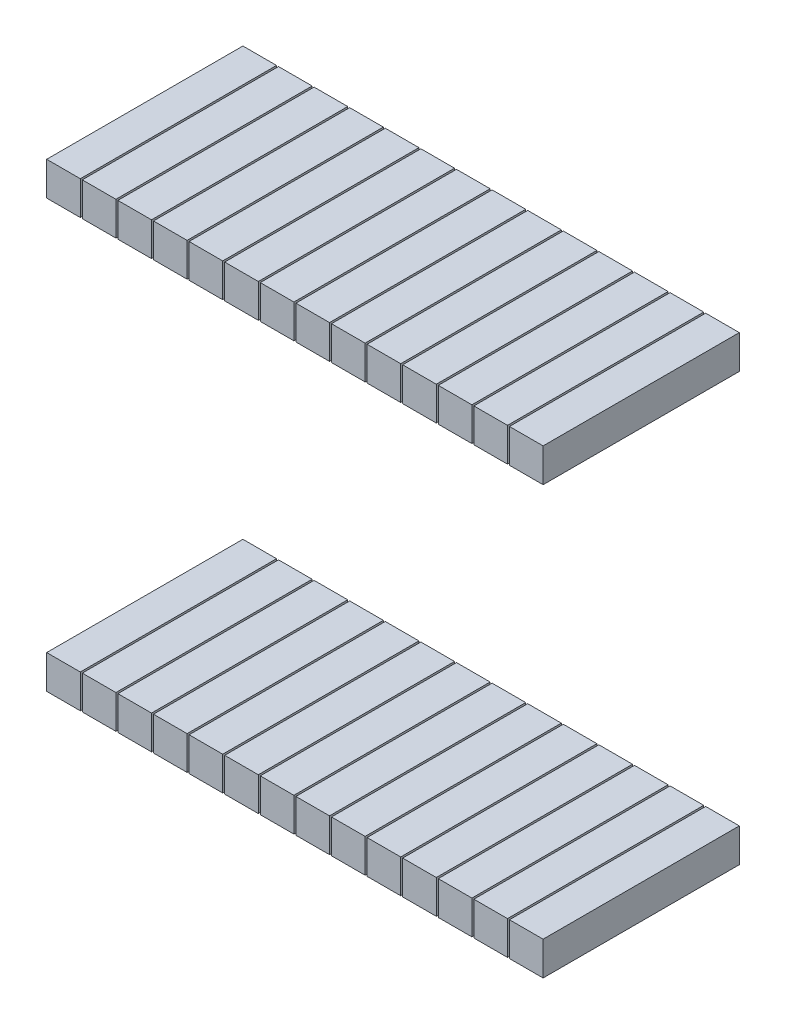
from build123d import *

# Parameters (mm, degrees)
HOUSINGS_SK1_W    = 2.4
HOUSINGS_SK1_H    = 2.4
HOUSINGS_DEPTH    = 14
HOUSINGS_2_DEPTH  = 14
HOUSINGS_3_DEPTH  = 14
HOUSINGS_4_DEPTH  = 14
HOUSINGS_5_DEPTH  = 14
HOUSINGS_6_DEPTH  = 14
HOUSINGS_7_DEPTH  = 14
HOUSINGS_8_DEPTH  = 14
HOUSINGS_9_DEPTH  = 14
HOUSINGS_10_DEPTH = 14
HOUSINGS_11_DEPTH = 14
HOUSINGS_12_DEPTH = 14
HOUSINGS_13_DEPTH = 14
HOUSINGS_14_DEPTH = 14
HOUSINGS_15_DEPTH = 14
HOUSINGS_16_DEPTH = 14
HOUSINGS_17_DEPTH = 14
HOUSINGS_18_DEPTH = 14
HOUSINGS_19_DEPTH = 14
HOUSINGS_20_DEPTH = 14
HOUSINGS_21_DEPTH = 14
HOUSINGS_22_DEPTH = 14
HOUSINGS_23_DEPTH = 14
HOUSINGS_24_DEPTH = 14
HOUSINGS_25_DEPTH = 14
HOUSINGS_26_DEPTH = 14
HOUSINGS_27_DEPTH = 14
HOUSINGS_28_DEPTH = 14


with BuildPart() as part:
    # Housings_Sk1 → Housings (new body)
    with BuildSketch(Plane.XY.offset(-9.8)):
        with Locations((-38.3, -4.65)):
            Rectangle(HOUSINGS_SK1_W, HOUSINGS_SK1_H)
    extrude(amount=-HOUSINGS_DEPTH)


with BuildPart() as body_2:
    # Housings_Sk1 → Housings 2 (new body)
    with BuildSketch(Plane.XY.offset(-9.8)):
        with Locations((-35.76, -4.65)):
            Rectangle(HOUSINGS_SK1_W, HOUSINGS_SK1_H)
    extrude(amount=-HOUSINGS_2_DEPTH)


with BuildPart() as body_3:
    # Housings_Sk1 → Housings 3 (new body)
    with BuildSketch(Plane.XY.offset(-9.8)):
        with Locations((-33.22, -4.65)):
            Rectangle(HOUSINGS_SK1_W, HOUSINGS_SK1_H)
    extrude(amount=-HOUSINGS_3_DEPTH)


with BuildPart() as body_4:
    # Housings_Sk1 → Housings 4 (new body)
    with BuildSketch(Plane.XY.offset(-9.8)):
        with Locations((-30.68, -4.65)):
            Rectangle(HOUSINGS_SK1_W, HOUSINGS_SK1_H)
    extrude(amount=-HOUSINGS_4_DEPTH)


with BuildPart() as body_5:
    # Housings_Sk1 → Housings 5 (new body)
    with BuildSketch(Plane.XY.offset(-9.8)):
        with Locations((-28.14, -4.65)):
            Rectangle(HOUSINGS_SK1_W, HOUSINGS_SK1_H)
    extrude(amount=-HOUSINGS_5_DEPTH)


with BuildPart() as body_6:
    # Housings_Sk1 → Housings 6 (new body)
    with BuildSketch(Plane.XY.offset(-9.8)):
        with Locations((-25.6, -4.65)):
            Rectangle(HOUSINGS_SK1_W, HOUSINGS_SK1_H)
    extrude(amount=-HOUSINGS_6_DEPTH)


with BuildPart() as body_7:
    # Housings_Sk1 → Housings 7 (new body)
    with BuildSketch(Plane.XY.offset(-9.8)):
        with Locations((-23.06, -4.65)):
            Rectangle(HOUSINGS_SK1_W, HOUSINGS_SK1_H)
    extrude(amount=-HOUSINGS_7_DEPTH)


with BuildPart() as body_8:
    # Housings_Sk1 → Housings 8 (new body)
    with BuildSketch(Plane.XY.offset(-9.8)):
        with Locations((-20.52, -4.65)):
            Rectangle(HOUSINGS_SK1_W, HOUSINGS_SK1_H)
    extrude(amount=-HOUSINGS_8_DEPTH)


with BuildPart() as body_9:
    # Housings_Sk1 → Housings 9 (new body)
    with BuildSketch(Plane.XY.offset(-9.8)):
        with Locations((-17.98, -4.65)):
            Rectangle(HOUSINGS_SK1_W, HOUSINGS_SK1_H)
    extrude(amount=-HOUSINGS_9_DEPTH)


with BuildPart() as body_10:
    # Housings_Sk1 → Housings 10 (new body)
    with BuildSketch(Plane.XY.offset(-9.8)):
        with Locations((-15.44, -4.65)):
            Rectangle(HOUSINGS_SK1_W, HOUSINGS_SK1_H)
    extrude(amount=-HOUSINGS_10_DEPTH)


with BuildPart() as body_11:
    # Housings_Sk1 → Housings 11 (new body)
    with BuildSketch(Plane.XY.offset(-9.8)):
        with Locations((-12.9, -4.65)):
            Rectangle(HOUSINGS_SK1_W, HOUSINGS_SK1_H)
    extrude(amount=-HOUSINGS_11_DEPTH)


with BuildPart() as body_12:
    # Housings_Sk1 → Housings 12 (new body)
    with BuildSketch(Plane.XY.offset(-9.8)):
        with Locations((-10.36, -4.65)):
            Rectangle(HOUSINGS_SK1_W, HOUSINGS_SK1_H)
    extrude(amount=-HOUSINGS_12_DEPTH)


with BuildPart() as body_13:
    # Housings_Sk1 → Housings 13 (new body)
    with BuildSketch(Plane.XY.offset(-9.8)):
        with Locations((-7.82, -4.65)):
            Rectangle(HOUSINGS_SK1_W, HOUSINGS_SK1_H)
    extrude(amount=-HOUSINGS_13_DEPTH)


with BuildPart() as body_14:
    # Housings_Sk1 → Housings 14 (new body)
    with BuildSketch(Plane.XY.offset(-9.8)):
        with Locations((-5.28, -4.65)):
            Rectangle(HOUSINGS_SK1_W, HOUSINGS_SK1_H)
    extrude(amount=-HOUSINGS_14_DEPTH)


with BuildPart() as body_15:
    # Housings_Sk1 → Housings 15 (new body)
    with BuildSketch(Plane.XY.offset(-9.8)):
        with Locations((-38.3, 25.83)):
            Rectangle(HOUSINGS_SK1_W, HOUSINGS_SK1_H)
    extrude(amount=-HOUSINGS_15_DEPTH)


with BuildPart() as body_16:
    # Housings_Sk1 → Housings 16 (new body)
    with BuildSketch(Plane.XY.offset(-9.8)):
        with Locations((-35.76, 25.83)):
            Rectangle(HOUSINGS_SK1_W, HOUSINGS_SK1_H)
    extrude(amount=-HOUSINGS_16_DEPTH)


with BuildPart() as body_17:
    # Housings_Sk1 → Housings 17 (new body)
    with BuildSketch(Plane.XY.offset(-9.8)):
        with Locations((-33.22, 25.83)):
            Rectangle(HOUSINGS_SK1_W, HOUSINGS_SK1_H)
    extrude(amount=-HOUSINGS_17_DEPTH)


with BuildPart() as body_18:
    # Housings_Sk1 → Housings 18 (new body)
    with BuildSketch(Plane.XY.offset(-9.8)):
        with Locations((-30.68, 25.83)):
            Rectangle(HOUSINGS_SK1_W, HOUSINGS_SK1_H)
    extrude(amount=-HOUSINGS_18_DEPTH)


with BuildPart() as body_19:
    # Housings_Sk1 → Housings 19 (new body)
    with BuildSketch(Plane.XY.offset(-9.8)):
        with Locations((-28.14, 25.83)):
            Rectangle(HOUSINGS_SK1_W, HOUSINGS_SK1_H)
    extrude(amount=-HOUSINGS_19_DEPTH)


with BuildPart() as body_20:
    # Housings_Sk1 → Housings 20 (new body)
    with BuildSketch(Plane.XY.offset(-9.8)):
        with Locations((-25.6, 25.83)):
            Rectangle(HOUSINGS_SK1_W, HOUSINGS_SK1_H)
    extrude(amount=-HOUSINGS_20_DEPTH)


with BuildPart() as body_21:
    # Housings_Sk1 → Housings 21 (new body)
    with BuildSketch(Plane.XY.offset(-9.8)):
        with Locations((-23.06, 25.83)):
            Rectangle(HOUSINGS_SK1_W, HOUSINGS_SK1_H)
    extrude(amount=-HOUSINGS_21_DEPTH)


with BuildPart() as body_22:
    # Housings_Sk1 → Housings 22 (new body)
    with BuildSketch(Plane.XY.offset(-9.8)):
        with Locations((-20.52, 25.83)):
            Rectangle(HOUSINGS_SK1_W, HOUSINGS_SK1_H)
    extrude(amount=-HOUSINGS_22_DEPTH)


with BuildPart() as body_23:
    # Housings_Sk1 → Housings 23 (new body)
    with BuildSketch(Plane.XY.offset(-9.8)):
        with Locations((-17.98, 25.83)):
            Rectangle(HOUSINGS_SK1_W, HOUSINGS_SK1_H)
    extrude(amount=-HOUSINGS_23_DEPTH)


with BuildPart() as body_24:
    # Housings_Sk1 → Housings 24 (new body)
    with BuildSketch(Plane.XY.offset(-9.8)):
        with Locations((-15.44, 25.83)):
            Rectangle(HOUSINGS_SK1_W, HOUSINGS_SK1_H)
    extrude(amount=-HOUSINGS_24_DEPTH)


with BuildPart() as body_25:
    # Housings_Sk1 → Housings 25 (new body)
    with BuildSketch(Plane.XY.offset(-9.8)):
        with Locations((-12.9, 25.83)):
            Rectangle(HOUSINGS_SK1_W, HOUSINGS_SK1_H)
    extrude(amount=-HOUSINGS_25_DEPTH)


with BuildPart() as body_26:
    # Housings_Sk1 → Housings 26 (new body)
    with BuildSketch(Plane.XY.offset(-9.8)):
        with Locations((-10.36, 25.83)):
            Rectangle(HOUSINGS_SK1_W, HOUSINGS_SK1_H)
    extrude(amount=-HOUSINGS_26_DEPTH)


with BuildPart() as body_27:
    # Housings_Sk1 → Housings 27 (new body)
    with BuildSketch(Plane.XY.offset(-9.8)):
        with Locations((-7.82, 25.83)):
            Rectangle(HOUSINGS_SK1_W, HOUSINGS_SK1_H)
    extrude(amount=-HOUSINGS_27_DEPTH)


with BuildPart() as body_28:
    # Housings_Sk1 → Housings 28 (new body)
    with BuildSketch(Plane.XY.offset(-9.8)):
        with Locations((-5.28, 25.83)):
            Rectangle(HOUSINGS_SK1_W, HOUSINGS_SK1_H)
    extrude(amount=-HOUSINGS_28_DEPTH)


solid = Compound([part.part, body_2.part, body_3.part, body_4.part, body_5.part, body_6.part, body_7.part, body_8.part, body_9.part, body_10.part, body_11.part, body_12.part, body_13.part, body_14.part, body_15.part, body_16.part, body_17.part, body_18.part, body_19.part, body_20.part, body_21.part, body_22.part, body_23.part, body_24.part, body_25.part, body_26.part, body_27.part, body_28.part])
